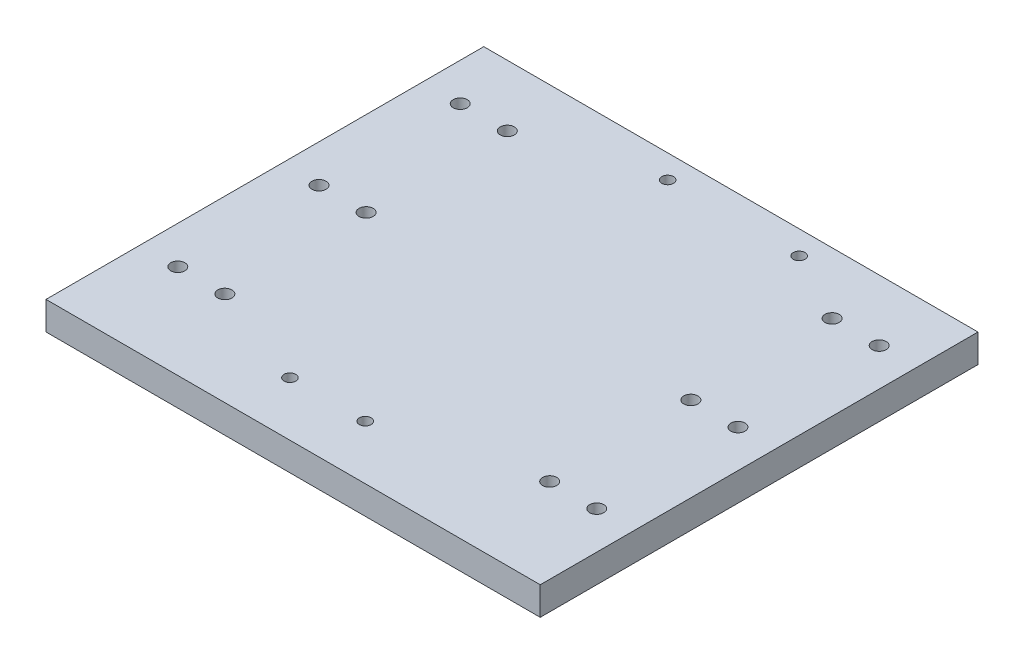
from build123d import *

# Parameters (mm, degrees)
ESQUISSE1_W        = 105
ESQUISSE1_H        = 93
ESQUISSE1_R        = 1.5
ESQUISSE1_R_2      = 1.25
BOSS_EXTRU_1_DEPTH = 6


with BuildPart() as part:
    # Esquisse1 → Boss.-Extru.1 (new body)
    with BuildSketch(Plane(origin=(0, 0, 0), x_dir=(1, 0, 0), z_dir=(0, 1, 0))):
        with Locations((0, 46.5)):
            Rectangle(ESQUISSE1_W, ESQUISSE1_H)
        with Locations(Location((34.5, 80, 0), (0, 0, 270))):
            Circle(ESQUISSE1_R, mode=Mode.SUBTRACT)
        with Locations(Location((44.5, 80, 0), (0, 0, 270))):
            Circle(ESQUISSE1_R, mode=Mode.SUBTRACT)
        with Locations(Location((34.5, 50, 0), (0, 0, 270))):
            Circle(ESQUISSE1_R, mode=Mode.SUBTRACT)
        with Locations(Location((44.5, 50, 0), (0, 0, 270))):
            Circle(ESQUISSE1_R, mode=Mode.SUBTRACT)
        with Locations(Location((34.5, 20, 0), (0, 0, 270))):
            Circle(ESQUISSE1_R, mode=Mode.SUBTRACT)
        with Locations(Location((44.5, 20, 0), (0, 0, 270))):
            Circle(ESQUISSE1_R, mode=Mode.SUBTRACT)
        with Locations(Location((-44.5, 20, 0), (0, 0, 90))):
            Circle(ESQUISSE1_R, mode=Mode.SUBTRACT)
        with Locations(Location((-34.5, 20, 0), (0, 0, 90))):
            Circle(ESQUISSE1_R, mode=Mode.SUBTRACT)
        with Locations(Location((-44.5, 50, 0), (0, 0, 90))):
            Circle(ESQUISSE1_R, mode=Mode.SUBTRACT)
        with Locations(Location((-34.5, 50, 0), (0, 0, 90))):
            Circle(ESQUISSE1_R, mode=Mode.SUBTRACT)
        with Locations(Location((-44.5, 80, 0), (0, 0, 90))):
            Circle(ESQUISSE1_R, mode=Mode.SUBTRACT)
        with Locations(Location((-34.5, 80, 0), (0, 0, 90))):
            Circle(ESQUISSE1_R, mode=Mode.SUBTRACT)
        with Locations(Location((-8.44, 88, 0), (0, 0, 270))):
            Circle(ESQUISSE1_R_2, mode=Mode.SUBTRACT)
        with Locations(Location((19.5, 88, 0), (0, 0, 270))):
            Circle(ESQUISSE1_R_2, mode=Mode.SUBTRACT)
        with Locations(Location((-12.18, 11.5, 0), (0, 0, 270))):
            Circle(ESQUISSE1_R_2, mode=Mode.SUBTRACT)
        with Locations(Location((3.82, 11.5, 0), (0, 0, 270))):
            Circle(ESQUISSE1_R_2, mode=Mode.SUBTRACT)
    extrude(amount=BOSS_EXTRU_1_DEPTH)


solid = part.part
